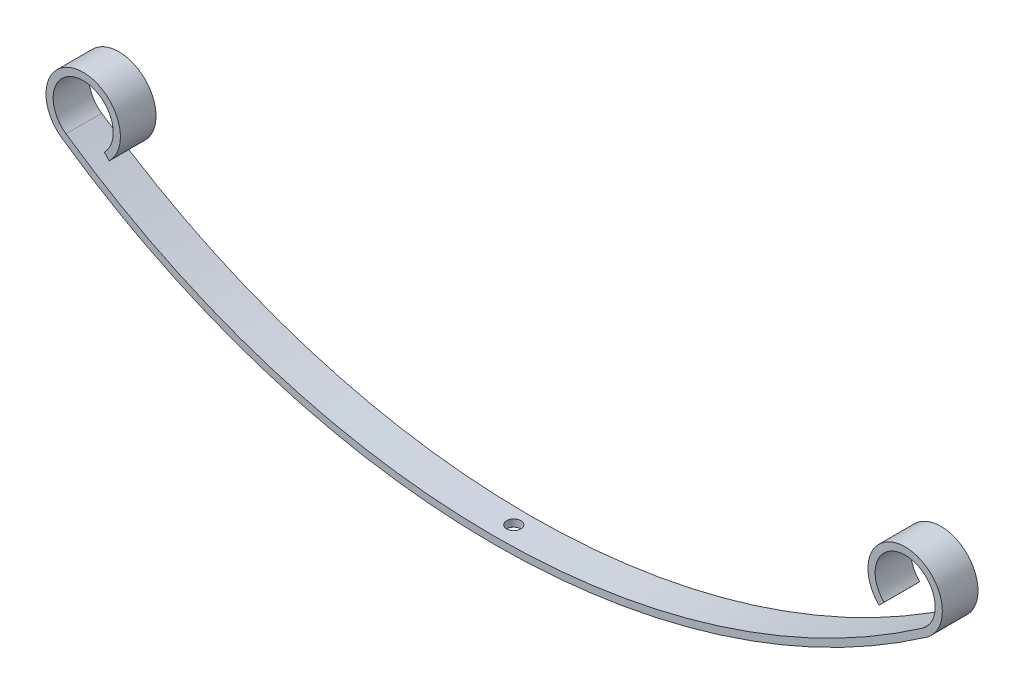
from build123d import *

# Parameters (mm, degrees)
BOSS_EXTRUDE1_DEPTH = 50
SKETCH3_R           = 10
CUT_EXTRUDE1_DEPTH  = 1234.101799213


with BuildPart() as part:
    # Sketch1 → Boss-Extrude1 (new body)
    with BuildSketch(Plane.XY):
        with BuildLine():
            Line((-546.37161216, -857.105521629), (-539.348809346, -864.224527221))
            ThreePointArc((-539.348809346, -864.224527221), (-580.373107294, -775.216346142), (-605.714285714, -869.890915047))
            ThreePointArc((-605.714285714, -869.890915047), (0, -1060), (605.714285714, -869.890915047))
            ThreePointArc((605.714285714, -869.890915047), (580.373107294, -775.216346142), (539.348809346, -864.224527221))
            Line((539.348809346, -864.224527221), (546.37161216, -857.105521629))
            ThreePointArc((546.37161216, -857.105521629), (579.522386954, -785.180094177), (600, -861.684396981))
            ThreePointArc((600, -861.684396981), (0, -1050), (-600, -861.684396981))
            ThreePointArc((-600, -861.684396981), (-579.522386954, -785.180094177), (-546.37161216, -857.105521629))
        make_face()
    extrude(amount=BOSS_EXTRUDE1_DEPTH)

    # Sketch3 → Cut-Extrude1 (cut, through all)
    with BuildSketch(Plane(origin=(0, 0, 0), x_dir=(1, 0, 0), z_dir=(0, 1, 0))):
        with Locations(Location((0, -22.5, 0), (0, 0, 270))):
            Circle(SKETCH3_R)
    extrude(amount=-CUT_EXTRUDE1_DEPTH, mode=Mode.SUBTRACT)


solid = part.part
